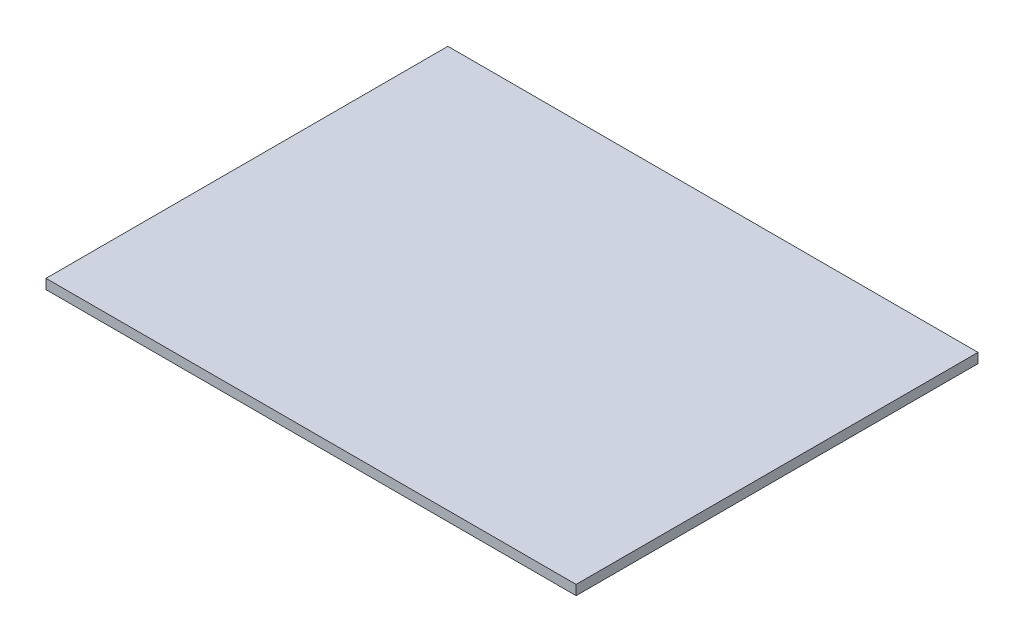
from build123d import *

# Parameters (mm, degrees)
CROQUIS1_W              = 811.2
CROQUIS1_H              = 615
SALIENTE_EXTRUIR1_DEPTH = 15


with BuildPart() as part:
    # Croquis1 → Saliente-Extruir1 (new body)
    with BuildSketch(Plane(origin=(0, 0, 0), x_dir=(1, 0, 0), z_dir=(0, 1, 0))):
        Rectangle(CROQUIS1_W, CROQUIS1_H)
    extrude(amount=SALIENTE_EXTRUIR1_DEPTH)


solid = part.part
